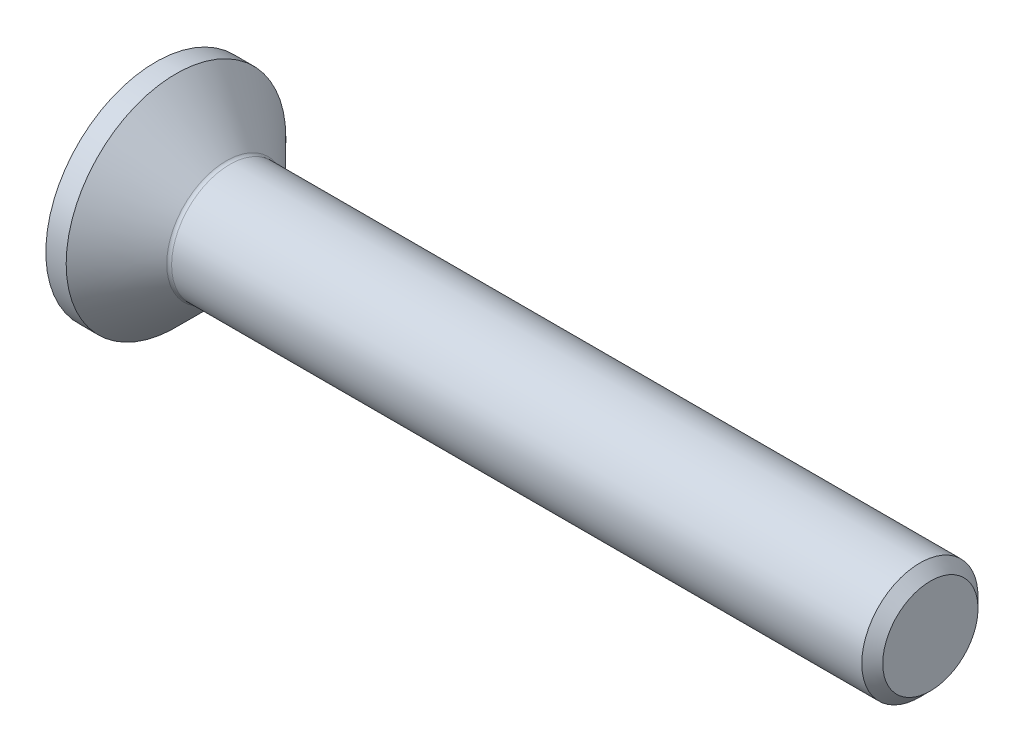
from build123d import *

# Parameters (mm, degrees)
HEXAGONSOCKET_DEPTH = 2.2
HEADFILLET_R        = 0.25
CHAMFER_2_SIZE      = 0.5415
SKETCH4_W           = 5
SKETCH4_H           = 5


with BuildPart() as part:
    # Sketch1 → Base (revolve)
    with BuildSketch(Plane.XY, mode=Mode.PRIVATE) as base_sk:
        Polygon((0, 0), (0, 6.72), (3.72, 3), (40, 3), (40, 0), align=None)
    revolve(base_sk.sketch.rotate(Axis((-0.587069181, 0, 0), (1, 0, 0)), 90), axis=Axis((-0.587069181, 0, 0), (1, 0, 0)))

    # Sketch2 → HexagonSocket (cut)
    with BuildSketch(Plane(origin=(0, 0, 0), x_dir=(0, 0, -1), z_dir=(1, 0, 0))):
        Polygon((2.309401077, 0), (1.154700538, 2), (-1.154700538, 2), (-2.309401077, 0), (-1.154700538, -2), (1.154700538, -2), align=None)
    extrude(amount=HEXAGONSOCKET_DEPTH, mode=Mode.SUBTRACT)

    # Sketch3 → Cut-Revolve1 (revolve, cut)
    with BuildSketch(Plane.XY, mode=Mode.PRIVATE) as cut_revolve1_sk:
        Polygon((2.2, 2), (3.354700538, 0), (2.2, 0), align=None)
    revolve(cut_revolve1_sk.sketch.rotate(Axis((-0.439109555, 0, 0), (1, 0, 0)), 90), axis=Axis((-0.439109555, 0, 0), (1, 0, 0)), mode=Mode.SUBTRACT)

    # HeadFillet
    headfillet_edges = [part.edges().sort_by_distance(p)[0] for p in [
        (3.72, 0, -3),
    ]]
    fillet(headfillet_edges, radius=HEADFILLET_R)

    # Chamfer 2
    chamfer_2_edges = [part.edges().sort_by_distance(p)[0] for p in [
        (40, 0, -3),
    ]]
    chamfer(chamfer_2_edges, length=CHAMFER_2_SIZE)

    # Sketch4 → Cut-Revolve2 (revolve, cut)
    with BuildSketch(Plane(origin=(0, 0, 0), x_dir=(1, 0, 0), z_dir=(0, 1, 0)), mode=Mode.PRIVATE) as cut_revolve2_sk:
        with Locations((0.5, 8.17)):
            Rectangle(SKETCH4_W, SKETCH4_H)
    revolve(cut_revolve2_sk.sketch.rotate(Axis((11.853138686, 0, 0), (-1, 0, 0)), 180), axis=Axis((11.853138686, 0, 0), (-1, 0, 0)), mode=Mode.SUBTRACT)


solid = part.part
